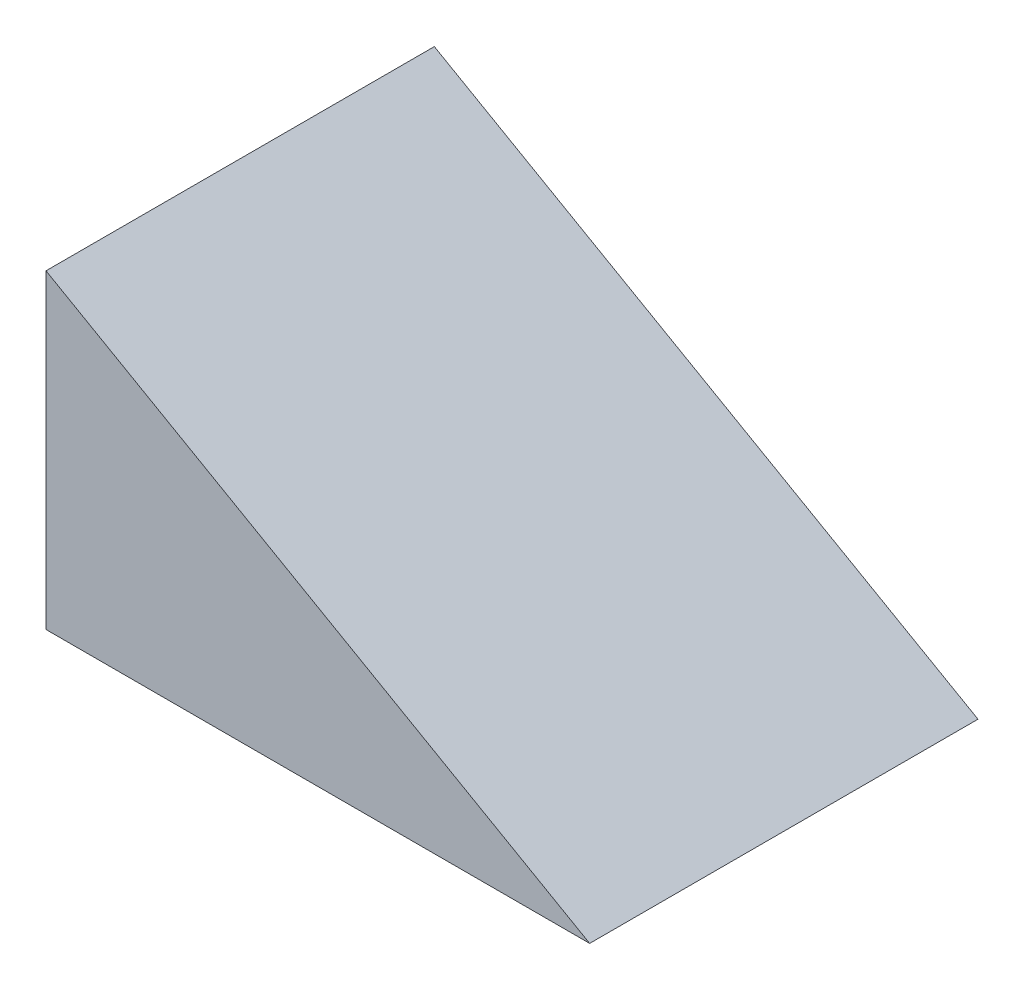
from build123d import *

# Parameters (mm, degrees)
BOSS_EXTRUDE1_DEPTH = 50


with BuildPart() as part:
    # Sketch1 → Boss-Extrude1 (new body)
    with BuildSketch(Plane.XY):
        Polygon((0, 0), (0, 40), (70, 0), align=None)
    extrude(amount=BOSS_EXTRUDE1_DEPTH)


solid = part.part
